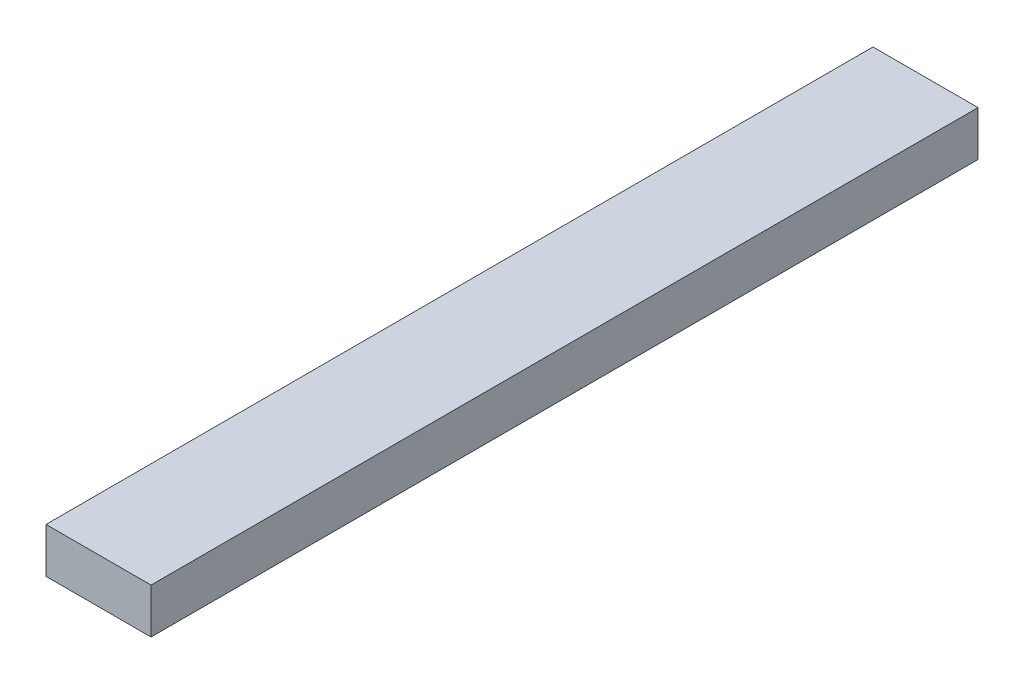
from build123d import *

# Parameters (mm, degrees)
SKETCH1_W           = 88.9
SKETCH1_H           = 38.1
BOSS_EXTRUDE1_DEPTH = 700


with BuildPart() as part:
    # Sketch1 → Boss-Extrude1 (new body)
    with BuildSketch(Plane.XY):
        Rectangle(SKETCH1_W, SKETCH1_H)
    extrude(amount=BOSS_EXTRUDE1_DEPTH)


solid = part.part
